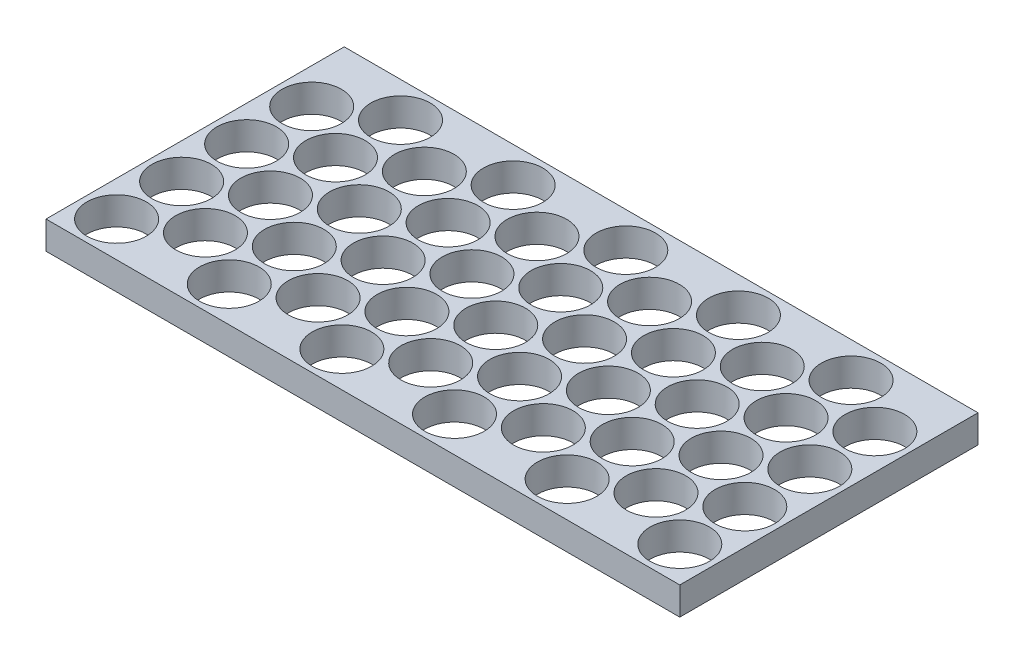
from build123d import *

# Parameters (mm, degrees)
SKETCH1_W            = 227.084
SKETCH1_H            = 106.85
BOSS_EXTRUDE1_DEPTH  = 10
SKETCH2_R            = 10.65
CUT_EXTRUDE1_DEPTH   = 22.3
LPATTERN1_COUNT      = 4
LPATTERN1_PITCH      = 23.3
LPATTERN1_COUNT_DIR2 = 6
LPATTERN1_PITCH_DIR2 = 40.356783816
SKETCH6_R            = 10.65
CUT_EXTRUDE2_DEPTH   = 252.165414729
LPATTERN2_COUNT      = 4
LPATTERN2_PITCH      = 23.3
LPATTERN2_COUNT_DIR2 = 5
LPATTERN2_PITCH_DIR2 = 40.356783816


with BuildPart() as part:
    # Sketch1 → Boss-Extrude1 (new body)
    with BuildSketch(Plane(origin=(0, 0, 0), x_dir=(1, 0, 0), z_dir=(0, 1, 0))):
        with Locations((113.542, 53.425)):
            Rectangle(SKETCH1_W, SKETCH1_H)
    extrude(amount=BOSS_EXTRUDE1_DEPTH)

    # Sketch2 → Cut-Extrude1 (cut)
    with BuildSketch(Plane(origin=(0, 10, 0), x_dir=(1, 0, 0), z_dir=(0, 1, 0))):
        with Locations(Location((12.65, 12.65, 0), (0, 0, 270))):
            Circle(SKETCH2_R)
    cut_extrude1 = extrude(amount=-CUT_EXTRUDE1_DEPTH, mode=Mode.SUBTRACT)

    # LPattern1: Cut-Extrude1 4 × 6
    with Locations(*[(j * LPATTERN1_PITCH_DIR2, 0, -i * LPATTERN1_PITCH) for i in range(LPATTERN1_COUNT) for j in range(LPATTERN1_COUNT_DIR2) if (i, j) != (0, 0)]):
        add(cut_extrude1, mode=Mode.SUBTRACT)

    # Sketch6 → Cut-Extrude2 (cut, through all)
    with BuildSketch(Plane(origin=(0, 10, 0), x_dir=(1, 0, 0), z_dir=(0, 1, 0))):
        with Locations(Location((32.828391908, 24.3, 0), (0, 0, 270))):
            Circle(SKETCH6_R)
    cut_extrude2 = extrude(amount=-CUT_EXTRUDE2_DEPTH, mode=Mode.SUBTRACT)

    # LPattern2: Cut-Extrude2 4 × 5
    with Locations(*[(j * LPATTERN2_PITCH_DIR2, 0, -i * LPATTERN2_PITCH) for i in range(LPATTERN2_COUNT) for j in range(LPATTERN2_COUNT_DIR2) if (i, j) != (0, 0)]):
        add(cut_extrude2, mode=Mode.SUBTRACT)


solid = part.part
